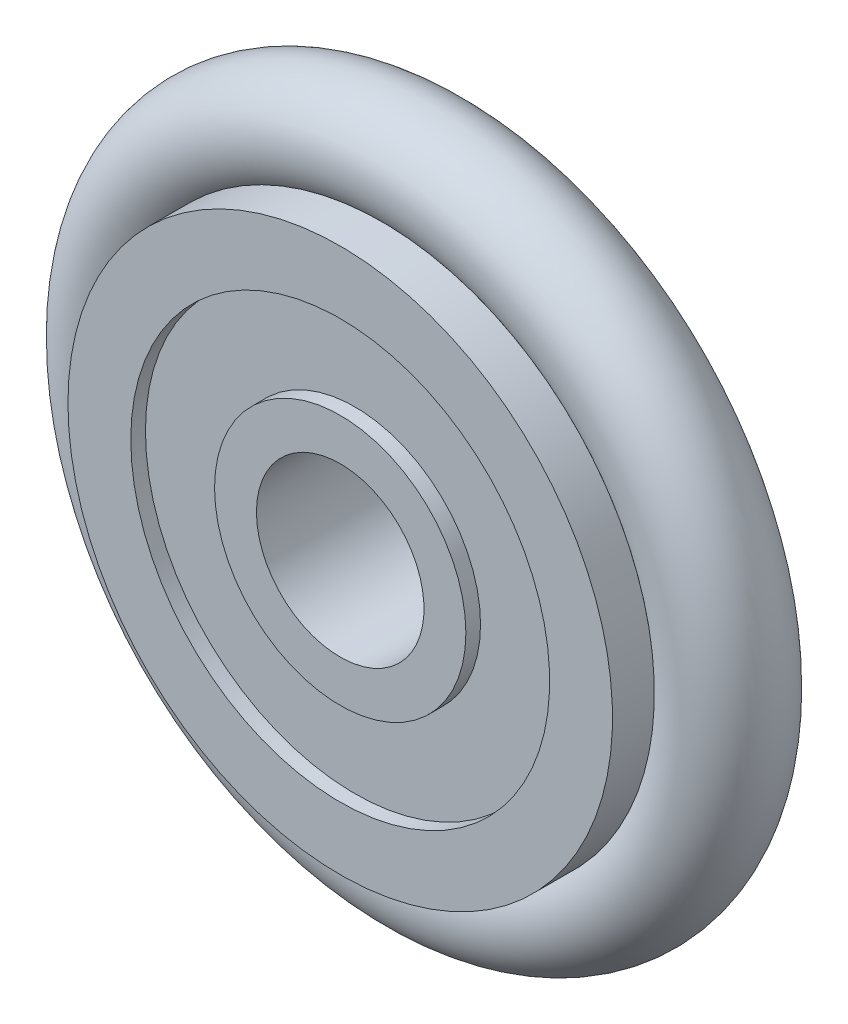
from build123d import *

# Parameters (mm, degrees)
SKETCH6_R = 1.25


with BuildPart() as part:
    # Sketch1 → Revolve1 (revolve)
    with BuildSketch(Plane(origin=(0, 0, 0), x_dir=(1, 0, 0), z_dir=(0, 1, 0)), mode=Mode.PRIVATE) as revolve1_sk:
        with BuildLine():
            Line((2, 2), (2, -2))
            Line((2, -2), (3, -2))
            Line((3, -2), (3, -1.65))
            Line((3, -1.65), (5, -1.65))
            Line((5, -1.65), (5, -2))
            Line((5, -2), (6.5, -2))
            Line((6.5, -2), (6.5, -1))
            ThreePointArc((6.5, -1), (6, 0), (6.5, 1))
            Line((6.5, 1), (6.5, 2))
            Line((6.5, 2), (5, 2))
            Line((5, 2), (5, 1.65))
            Line((5, 1.65), (3, 1.65))
            Line((3, 1.65), (3, 2))
            Line((3, 2), (2, 2))
        make_face()
    revolve(revolve1_sk.sketch.rotate(Axis((0, 0, -2), (0, 0, 1)), 180), axis=Axis((0, 0, -2), (0, 0, 1)))


with BuildPart() as body_2:
    # Sketch6 → O-Ring Revolve (revolve)
    with BuildSketch(Plane(origin=(0, 0, 0), x_dir=(1, 0, 0), z_dir=(0, 1, 0))):
        with Locations((7.25, 0)):
            Circle(SKETCH6_R)
    revolve(axis=Axis((0, 0, 0), (0, 0, -1)))


solid = Compound([part.part, body_2.part])
